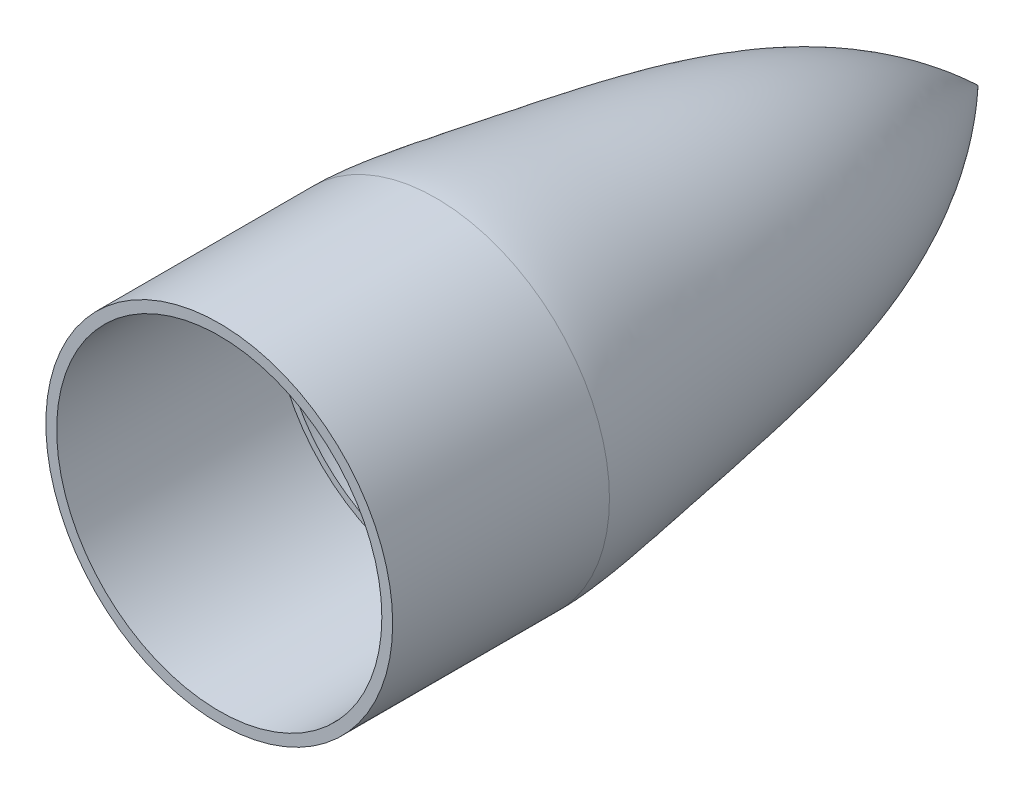
from build123d import *

# Parameters (mm, degrees)
SKETCH_1_W = 1
SKETCH_1_H = 20


with BuildPart() as part:
    # 草图1 → 旋转1 (revolve)
    with BuildSketch(Plane(origin=(0, 0, 0), x_dir=(1, 0, 0), z_dir=(0, 1, 0))):
        with BuildLine():
            add(Edge.make_bspline(
                [(14.4, 20), (14.4, 22.156924327), (10.88975842, 43.03780354), (10.62077223, 57.316316781), (0, 68.4)],
                knots=[0, 0, 0, 0, 0.204356336, 1, 1, 1, 1], degree=3))
            Line((0, 68.4), (0, 70))
            add(Edge.make_bspline(
                [(16, 20), (16, 23.007721561), (12.442475671, 43.750318452), (10.357640651, 59.089277422), (0, 70)],
                knots=[0, 0, 0, 0, 0.236447312, 1, 1, 1, 1], degree=3))
            Line((16, 20), (15, 20))
            Line((15, 20), (14.4, 20))
        make_face()
        with Locations((15.5, 10)):
            Rectangle(SKETCH_1_W, SKETCH_1_H)
    revolve(axis=Axis((0, 0, -21.208130678), (0, 0, -1)))


solid = part.part
